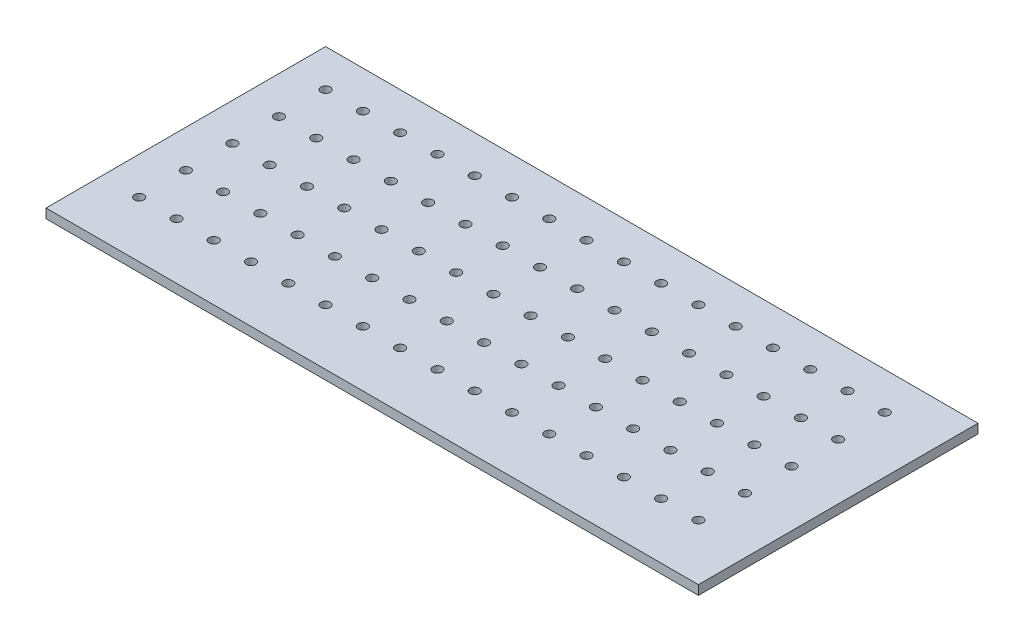
from build123d import *

# Parameters (mm, degrees)
CROQUIS1_W              = 700
CROQUIS1_H              = 300
SALIENTE_EXTRUIR1_DEPTH = 10
CROQUIS2_R              = 5
CORTAR_EXTRUIR1_DEPTH   = 10
MATRIZL1_COUNT          = 16
MATRIZL1_PITCH          = 40
MATRIZL1_COUNT_DIR2     = 5
MATRIZL1_PITCH_DIR2     = 50


with BuildPart() as part:
    # Croquis1 → Saliente-Extruir1 (new body)
    with BuildSketch(Plane(origin=(0, 0, 0), x_dir=(1, 0, 0), z_dir=(0, 1, 0))):
        Rectangle(CROQUIS1_W, CROQUIS1_H)
    extrude(amount=SALIENTE_EXTRUIR1_DEPTH)

    # Croquis2 → Cortar-Extruir1 (cut)
    with BuildSketch(Plane(origin=(0, 10, 0), x_dir=(1, 0, 0), z_dir=(0, 1, 0))):
        with Locations(Location((-310, 110, 0), (0, 0, 270))):
            Circle(CROQUIS2_R)
    cortar_extruir1 = extrude(amount=-CORTAR_EXTRUIR1_DEPTH, mode=Mode.SUBTRACT)

    # MatrizL1: Cortar-Extruir1 16 × 5
    with Locations(*[(i * MATRIZL1_PITCH, 0, j * MATRIZL1_PITCH_DIR2) for i in range(MATRIZL1_COUNT) for j in range(MATRIZL1_COUNT_DIR2) if (i, j) != (0, 0)]):
        add(cortar_extruir1, mode=Mode.SUBTRACT)


solid = part.part
